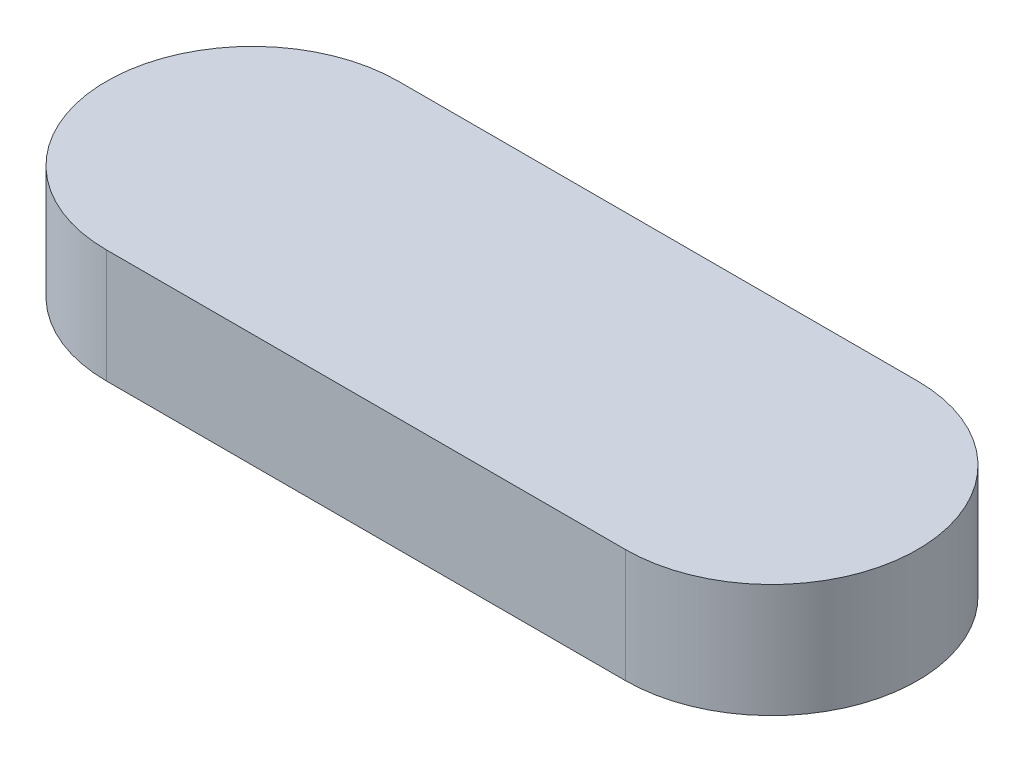
from build123d import *

# Parameters (mm, degrees)
BOSS_EXTRUDE1_DEPTH = 7


with BuildPart() as part:
    # Sketch1 → Boss-Extrude1 (new body)
    with BuildSketch(Plane(origin=(0, 0, 0), x_dir=(1, 0, 0), z_dir=(0, 1, 0))):
        with BuildLine():
            Line((-16, 9), (16, 9))
            ThreePointArc((16, 9), (25, 0), (16, -9))
            Line((16, -9), (-16, -9))
            ThreePointArc((-16, -9), (-25, 0), (-16, 9))
        make_face()
    extrude(amount=BOSS_EXTRUDE1_DEPTH)


solid = part.part
